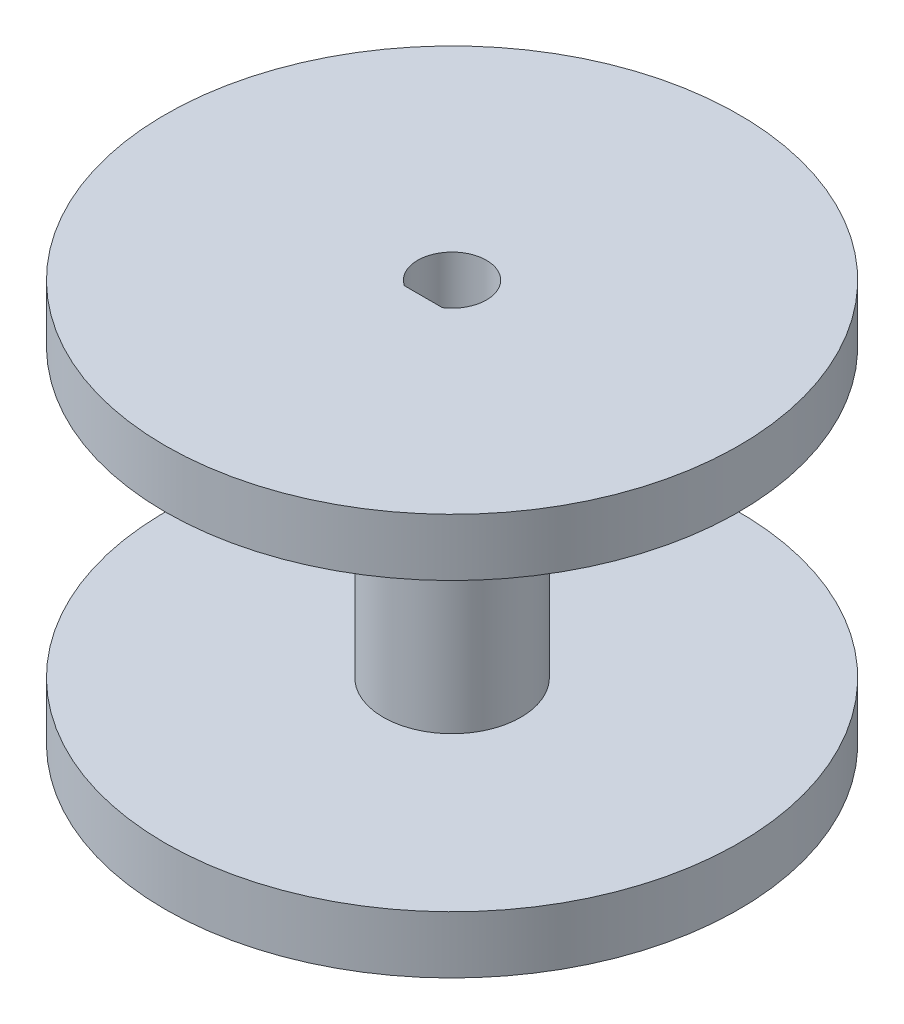
from build123d import *

# Parameters (mm, degrees)
SKETCH1_R           = 25
BOSS_EXTRUDE1_DEPTH = 5
SKETCH2_R           = 6
BOSS_EXTRUDE2_DEPTH = 25
SKETCH3_R           = 25
BOSS_EXTRUDE3_DEPTH = 5
CUT_EXTRUDE1_DEPTH  = 10


with BuildPart() as part:
    # Sketch1 → Boss-Extrude1 (new body)
    with BuildSketch(Plane(origin=(0, 0, 0), x_dir=(1, 0, 0), z_dir=(0, 1, 0))):
        with Locations(Location((0, 0, 0), (0, 0, 270))):
            Circle(SKETCH1_R)
    extrude(amount=BOSS_EXTRUDE1_DEPTH)

    # Sketch2 → Boss-Extrude2 (add)
    with BuildSketch(Plane(origin=(0, 5, 0), x_dir=(1, 0, 0), z_dir=(0, 1, 0))):
        with Locations(Location((0, 0, 0), (0, 0, 270))):
            Circle(SKETCH2_R)
    extrude(amount=BOSS_EXTRUDE2_DEPTH)

    # Sketch3 → Boss-Extrude3 (add)
    with BuildSketch(Plane(origin=(0, 30, 0), x_dir=(1, 0, 0), z_dir=(0, 1, 0))):
        with Locations(Location((0, 0, 0), (0, 0, 270))):
            Circle(SKETCH3_R)
    extrude(amount=BOSS_EXTRUDE3_DEPTH)

    # Sketch4 → Cut-Extrude1 (cut)
    with BuildSketch(Plane(origin=(0, 35, 0), x_dir=(1, 0, 0), z_dir=(0, 1, 0))):
        with BuildLine():
            Line((0, -2.5), (-1.658312395, -2.5))
            ThreePointArc((-1.658312395, -2.5), (0, 3), (1.658312395, -2.5))
            Line((1.658312395, -2.5), (0, -2.5))
        make_face()
    extrude(amount=-CUT_EXTRUDE1_DEPTH, mode=Mode.SUBTRACT)


solid = part.part
